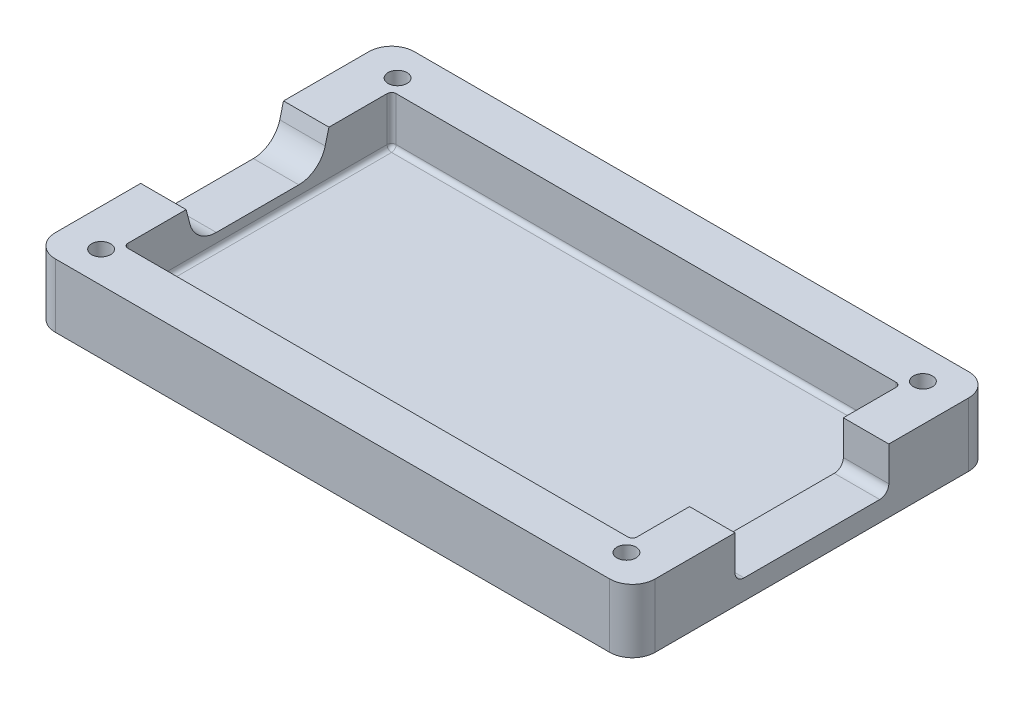
from build123d import *

# Parameters (mm, degrees)
SKETCH1_W           = 33.528
SKETCH1_H           = 20.066
BOSS_EXTRUDE1_DEPTH = 3.556
SKETCH2_W           = 28.448
SKETCH2_H           = 14.986
CUT_EXTRUDE1_DEPTH  = 2.72199989
CUT_EXTRUDE2_REACH  = 37.177
SKETCH3_W           = 8.599089176
SKETCH3_H           = 2.434237831
CUT_EXTRUDE3_REACH  = 37.177
FILLET1_R           = 1.524
FILLET2_R           = 0.508
FILLET3_R           = 1.27
SKETCH7_R           = 0.911071032
CUT_EXTRUDE4_DEPTH  = 1.27
SKETCH9_R           = 0.530860858
CUT_EXTRUDE5_DEPTH  = 20.857943524
FILLET4_R           = 0.254
FILLET5_R           = 0.254


with BuildPart() as part:
    # Sketch1 → Boss-Extrude1 (new body)
    with BuildSketch(Plane(origin=(0, 0, 0), x_dir=(1, 0, 0), z_dir=(0, 1, 0))):
        Rectangle(SKETCH1_W, SKETCH1_H)
    extrude(amount=BOSS_EXTRUDE1_DEPTH)

    # Sketch2 → Cut-Extrude1 (cut)
    with BuildSketch(Plane(origin=(0, 3.556, 0), x_dir=(1, 0, 0), z_dir=(0, 1, 0))):
        Rectangle(SKETCH2_W, SKETCH2_H)
    extrude(amount=-CUT_EXTRUDE1_DEPTH, mode=Mode.SUBTRACT)

    # Sketch3 → Cut-Extrude2 (cut, up to next)
    with BuildSketch(Plane(origin=(16.764, 0, 0), x_dir=(0, 0, -1), z_dir=(1, 0, 0)), mode=Mode.PRIVATE) as cut_extrude2_sk1:
        with Locations((0, 2.338881085)):
            Rectangle(SKETCH3_W, SKETCH3_H)
    cut_extrude2_tool1 = extrude(cut_extrude2_sk1.sketch, amount=-CUT_EXTRUDE2_REACH, mode=Mode.PRIVATE) & part.part
    add(cut_extrude2_tool1.solids().sort_by_distance((16.764, 2.338881, 0))[0], mode=Mode.SUBTRACT)

    # Sketch5 → Cut-Extrude3 (cut, up to next)
    with BuildSketch(Plane.ZY.offset(16.764), mode=Mode.PRIVATE) as cut_extrude3_sk1:
        Polygon((-3.991394218, 3.556), (3.991394218, 3.556), (3.484543993, 1.607179709), (-3.484543993, 1.607179709), align=None)
    cut_extrude3_tool1 = extrude(cut_extrude3_sk1.sketch, amount=-CUT_EXTRUDE3_REACH, mode=Mode.PRIVATE) & part.part
    add(cut_extrude3_tool1.solids().sort_by_distance((-16.764, 2.603611, 0))[0], mode=Mode.SUBTRACT)

    # Fillet1
    fillet1_edges = [part.edges().sort_by_distance(p)[0] for p in [
        (-15.494, 1.607179709, -3.484543993),
        (-15.494, 1.607179709, 3.484543993),
    ]]
    fillet(fillet1_edges, radius=FILLET1_R)

    # Fillet2
    fillet2_edges = [part.edges().sort_by_distance(p)[0] for p in [
        (15.494, 1.121762169, 4.299544588),
        (15.494, 1.121762169, -4.299544588),
    ]]
    fillet(fillet2_edges, radius=FILLET2_R)

    # Fillet3
    fillet3_edges = [part.edges().sort_by_distance(p)[0] for p in [
        (16.764, 1.778, 10.033),
        (-16.764, 1.778, 10.033),
        (-16.764, 1.778, -10.033),
        (16.764, 1.778, -10.033),
    ]]
    fillet(fillet3_edges, radius=FILLET3_R)

    # Sketch7 → Cut-Extrude4 (cut)
    with BuildSketch(Plane.XZ):
        with Locations(Location((-14.683903523, 8.287062989, 0), (0, 0, 270))):
            Circle(SKETCH7_R)
        with Locations(Location((14.683903523, 8.287062989, 0), (0, 0, 270))):
            Circle(SKETCH7_R)
        with Locations(Location((14.683903523, -8.287062989, 0), (0, 0, 270))):
            Circle(SKETCH7_R)
        with Locations(Location((-14.683903523, -8.287062989, 0), (0, 0, 270))):
            Circle(SKETCH7_R)
    extrude(amount=-CUT_EXTRUDE4_DEPTH, mode=Mode.SUBTRACT)

    # Sketch9 → Cut-Extrude5 (cut, through all)
    with BuildSketch(Plane.XZ):
        with Locations(Location((-14.683903523, 8.287062989, 0), (0, 0, 270))):
            Circle(SKETCH9_R)
        with Locations(Location((14.683903523, 8.287062989, 0), (0, 0, 270))):
            Circle(SKETCH9_R)
        with Locations(Location((14.683903523, -8.287062989, 0), (0, 0, 270))):
            Circle(SKETCH9_R)
        with Locations(Location((-14.683903523, -8.287062989, 0), (0, 0, 270))):
            Circle(SKETCH9_R)
    extrude(amount=-CUT_EXTRUDE5_DEPTH, mode=Mode.SUBTRACT)

    # Fillet4
    fillet4_edges = [part.edges().sort_by_distance(p)[0] for p in [
        (14.224, 2.195000055, -7.493),
        (14.224, 2.195000055, 7.493),
        (-14.224, 2.195000055, 7.493),
        (-14.224, 2.195000055, -7.493),
    ]]
    fillet(fillet4_edges, radius=FILLET4_R)

    # Fillet5
    fillet5_edges = [part.edges().sort_by_distance(p)[0] for p in [
        (14.224, 0.83400011, 0),
        (0, 0.83400011, 7.493),
        (0, 0.83400011, -7.493),
        (-14.224, 0.83400011, 0),
        (-14.149605122, 0.83400011, -7.418605122),
        (14.149605122, 0.83400011, -7.418605122),
        (-14.149605122, 0.83400011, 7.418605122),
        (14.149605122, 0.83400011, 7.418605122),
    ]]
    fillet(fillet5_edges, radius=FILLET5_R)


solid = part.part
